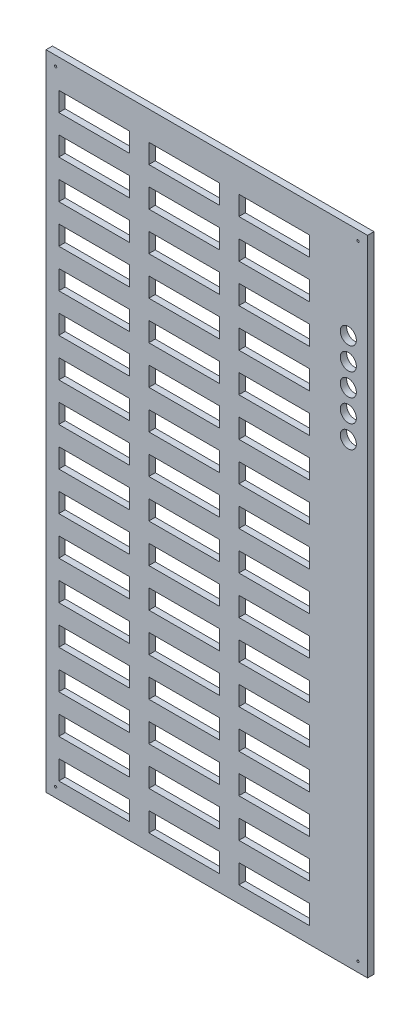
from build123d import *

# Parameters (mm, degrees)
ESQUISSE1_W             = 500
ESQUISSE1_H             = 1000
ESQUISSE1_R             = 1.75
ESQUISSE1_R_2           = 12.5
BOSS_EXTRU_1_DEPTH      = 10
ESQUISSE3_W             = 110
ESQUISSE3_H             = 30
ENL_V_MAT_EXTRU_2_DEPTH = 10


with BuildPart() as part:
    # Esquisse1 → Boss.-Extru.1 (new body)
    with BuildSketch(Plane.XY):
        Rectangle(ESQUISSE1_W, ESQUISSE1_H)
        with Locations((235, 485)):
            Circle(ESQUISSE1_R, mode=Mode.SUBTRACT)
        with Locations(Location((235, -485, 0), (0, 0, 180))):
            Circle(ESQUISSE1_R, mode=Mode.SUBTRACT)
        with Locations((220, 350)):
            Circle(ESQUISSE1_R_2, mode=Mode.SUBTRACT)
        with Locations((220, 315)):
            Circle(ESQUISSE1_R_2, mode=Mode.SUBTRACT)
        with Locations((220, 245)):
            Circle(ESQUISSE1_R_2, mode=Mode.SUBTRACT)
        with Locations((220, 280)):
            Circle(ESQUISSE1_R_2, mode=Mode.SUBTRACT)
        with Locations((220, 210)):
            Circle(ESQUISSE1_R_2, mode=Mode.SUBTRACT)
        with Locations((-235, -485)):
            Circle(ESQUISSE1_R, mode=Mode.SUBTRACT)
        with Locations(Location((-235, 485, 0), (0, 0, 180))):
            Circle(ESQUISSE1_R, mode=Mode.SUBTRACT)
    extrude(amount=BOSS_EXTRU_1_DEPTH)

    # Esquisse3 → Enlèv. mat.-Extru.2 (cut)
    with BuildSketch(Plane.XY.offset(10)):
        with Locations((-175.129528505, 440.340117166)):
            Rectangle(ESQUISSE3_W, ESQUISSE3_H)
        with Locations((-35.129528505, 440.340117166)):
            Rectangle(ESQUISSE3_W, ESQUISSE3_H)
        with Locations((104.870471495, 440.340117166)):
            Rectangle(ESQUISSE3_W, ESQUISSE3_H)
        with Locations((-35.129528505, 380.340117166)):
            Rectangle(ESQUISSE3_W, ESQUISSE3_H)
        with Locations((104.870471495, 380.340117166)):
            Rectangle(ESQUISSE3_W, ESQUISSE3_H)
        with Locations((-35.129528505, 320.340117166)):
            Rectangle(ESQUISSE3_W, ESQUISSE3_H)
        with Locations((104.870471495, 320.340117166)):
            Rectangle(ESQUISSE3_W, ESQUISSE3_H)
        with Locations((-35.129528505, 260.340117166)):
            Rectangle(ESQUISSE3_W, ESQUISSE3_H)
        with Locations((104.870471495, 260.340117166)):
            Rectangle(ESQUISSE3_W, ESQUISSE3_H)
        with Locations((-35.129528505, 200.340117166)):
            Rectangle(ESQUISSE3_W, ESQUISSE3_H)
        with Locations((104.870471495, 200.340117166)):
            Rectangle(ESQUISSE3_W, ESQUISSE3_H)
        with Locations((-35.129528505, 140.340117166)):
            Rectangle(ESQUISSE3_W, ESQUISSE3_H)
        with Locations((104.870471495, 140.340117166)):
            Rectangle(ESQUISSE3_W, ESQUISSE3_H)
        with Locations((-35.129528505, 80.340117166)):
            Rectangle(ESQUISSE3_W, ESQUISSE3_H)
        with Locations((104.870471495, 80.340117166)):
            Rectangle(ESQUISSE3_W, ESQUISSE3_H)
        with Locations((-35.129528505, 20.340117166)):
            Rectangle(ESQUISSE3_W, ESQUISSE3_H)
        with Locations((104.870471495, 20.340117166)):
            Rectangle(ESQUISSE3_W, ESQUISSE3_H)
        with Locations((-35.129528505, -39.659882834)):
            Rectangle(ESQUISSE3_W, ESQUISSE3_H)
        with Locations((104.870471495, -39.659882834)):
            Rectangle(ESQUISSE3_W, ESQUISSE3_H)
        with Locations((-35.129528505, -99.659882834)):
            Rectangle(ESQUISSE3_W, ESQUISSE3_H)
        with Locations((104.870471495, -99.659882834)):
            Rectangle(ESQUISSE3_W, ESQUISSE3_H)
        with Locations((-35.129528505, -159.659882834)):
            Rectangle(ESQUISSE3_W, ESQUISSE3_H)
        with Locations((104.870471495, -159.659882834)):
            Rectangle(ESQUISSE3_W, ESQUISSE3_H)
        with Locations((-35.129528505, -219.659882834)):
            Rectangle(ESQUISSE3_W, ESQUISSE3_H)
        with Locations((104.870471495, -219.659882834)):
            Rectangle(ESQUISSE3_W, ESQUISSE3_H)
        with Locations((-35.129528505, -279.659882834)):
            Rectangle(ESQUISSE3_W, ESQUISSE3_H)
        with Locations((104.870471495, -279.659882834)):
            Rectangle(ESQUISSE3_W, ESQUISSE3_H)
        with Locations((-35.129528505, -339.659882834)):
            Rectangle(ESQUISSE3_W, ESQUISSE3_H)
        with Locations((104.870471495, -339.659882834)):
            Rectangle(ESQUISSE3_W, ESQUISSE3_H)
        with Locations((-35.129528505, -399.659882834)):
            Rectangle(ESQUISSE3_W, ESQUISSE3_H)
        with Locations((104.870471495, -399.659882834)):
            Rectangle(ESQUISSE3_W, ESQUISSE3_H)
        with Locations((-35.129528505, -459.659882834)):
            Rectangle(ESQUISSE3_W, ESQUISSE3_H)
        with Locations((104.870471495, -459.659882834)):
            Rectangle(ESQUISSE3_W, ESQUISSE3_H)
        with Locations((-175.129528505, 380.340117166)):
            Rectangle(ESQUISSE3_W, ESQUISSE3_H)
        with Locations((-175.129528505, 320.340117166)):
            Rectangle(ESQUISSE3_W, ESQUISSE3_H)
        with Locations((-175.129528505, 260.340117166)):
            Rectangle(ESQUISSE3_W, ESQUISSE3_H)
        with Locations((-175.129528505, 200.340117166)):
            Rectangle(ESQUISSE3_W, ESQUISSE3_H)
        with Locations((-175.129528505, 140.340117166)):
            Rectangle(ESQUISSE3_W, ESQUISSE3_H)
        with Locations((-175.129528505, 80.340117166)):
            Rectangle(ESQUISSE3_W, ESQUISSE3_H)
        with Locations((-175.129528505, 20.340117166)):
            Rectangle(ESQUISSE3_W, ESQUISSE3_H)
        with Locations((-175.129528505, -39.659882834)):
            Rectangle(ESQUISSE3_W, ESQUISSE3_H)
        with Locations((-175.129528505, -99.659882834)):
            Rectangle(ESQUISSE3_W, ESQUISSE3_H)
        with Locations((-175.129528505, -159.659882834)):
            Rectangle(ESQUISSE3_W, ESQUISSE3_H)
        with Locations((-175.129528505, -219.659882834)):
            Rectangle(ESQUISSE3_W, ESQUISSE3_H)
        with Locations((-175.129528505, -279.659882834)):
            Rectangle(ESQUISSE3_W, ESQUISSE3_H)
        with Locations((-175.129528505, -339.659882834)):
            Rectangle(ESQUISSE3_W, ESQUISSE3_H)
        with Locations((-175.129528505, -399.659882834)):
            Rectangle(ESQUISSE3_W, ESQUISSE3_H)
        with Locations((-175.129528505, -459.659882834)):
            Rectangle(ESQUISSE3_W, ESQUISSE3_H)
    extrude(amount=-ENL_V_MAT_EXTRU_2_DEPTH, mode=Mode.SUBTRACT)


solid = part.part
